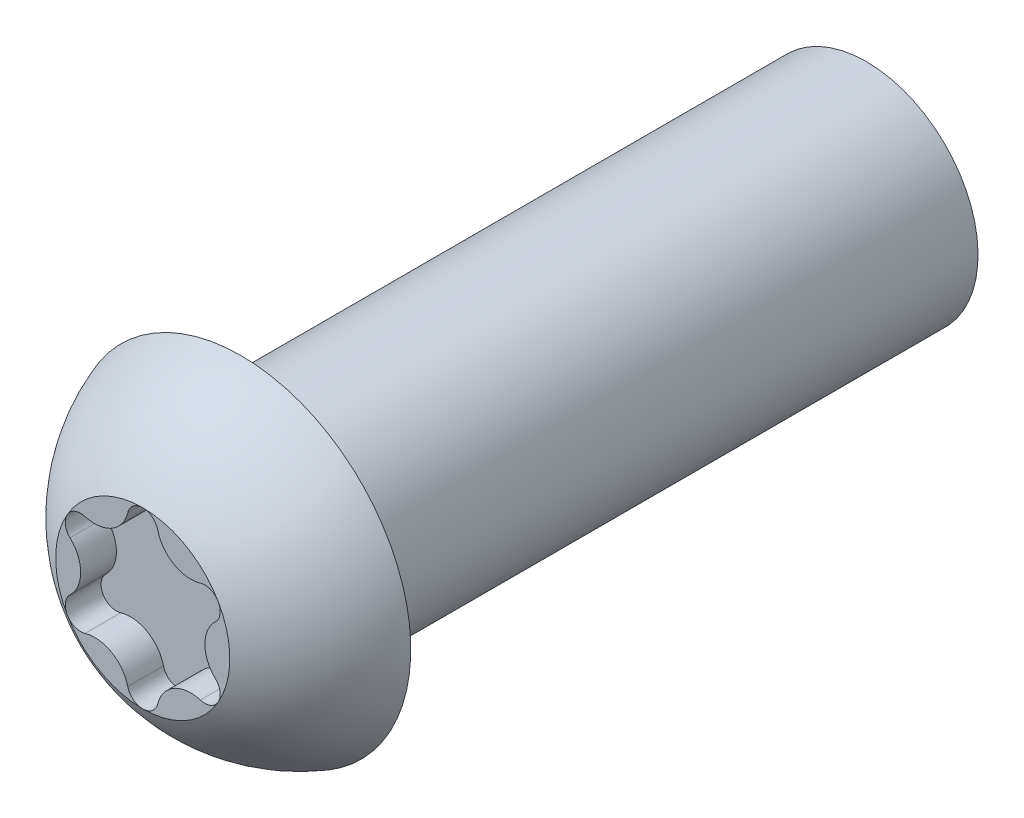
from build123d import *

# Parameters (mm, degrees)
ENL_V_MAT_EXTRU_1_DEPTH = 0.8


with BuildPart() as part:
    # Esquisse1 → Révolution1 (revolve)
    with BuildSketch(Plane(origin=(0, 0, 0), x_dir=(0, 0, -1), z_dir=(1, 0, 0))):
        with BuildLine():
            Line((-2.2, 0), (-2.2, 1.95))
            ThreePointArc((-2.2, 1.95), (-1.270915037, 3.078250315), (0, 3.8))
            Line((0, 3.8), (0, 2.5))
            Line((0, 2.5), (14, 2.5))
            Line((14, 2.5), (14, 0))
            Line((14, 0), (-2.2, 0))
        make_face()
    revolve(axis=Axis((0, 0, 2.2), (0, 0, 1)))

    # Esquisse2 → Enlèv. mat.-Extru.1 (cut)
    with BuildSketch(Plane.XY.offset(2.2)):
        with BuildLine():
            ThreePointArc((-0.335299912, 1.68566649), (0, 1.95), (0.335299912, 1.68566649))
            ThreePointArc((0.335299912, 1.68566649), (0.695060647, 1.203880356), (1.292180047, 1.133211487))
            ThreePointArc((1.292180047, 1.133211487), (1.688749537, 0.975), (1.627479959, 0.552455003))
            ThreePointArc((1.627479959, 0.552455003), (1.390121295, 0), (1.627479959, -0.552455003))
            ThreePointArc((1.627479959, -0.552455003), (1.688749537, -0.975), (1.292180047, -1.133211487))
            ThreePointArc((1.292180047, -1.133211487), (0.695060647, -1.203880356), (0.335299912, -1.68566649))
            ThreePointArc((0.335299912, -1.68566649), (0, -1.95), (-0.335299912, -1.68566649))
            ThreePointArc((-0.335299912, -1.68566649), (-0.695060647, -1.203880356), (-1.292180047, -1.133211487))
            ThreePointArc((-1.292180047, -1.133211487), (-1.688749537, -0.975), (-1.627479959, -0.552455003))
            ThreePointArc((-1.627479959, -0.552455003), (-1.390121295, 0), (-1.627479959, 0.552455003))
            ThreePointArc((-1.627479959, 0.552455003), (-1.688749537, 0.975), (-1.292180047, 1.133211487))
            ThreePointArc((-1.292180047, 1.133211487), (-0.695060647, 1.203880356), (-0.335299912, 1.68566649))
        make_face()
    extrude(amount=-ENL_V_MAT_EXTRU_1_DEPTH, mode=Mode.SUBTRACT)


solid = part.part
